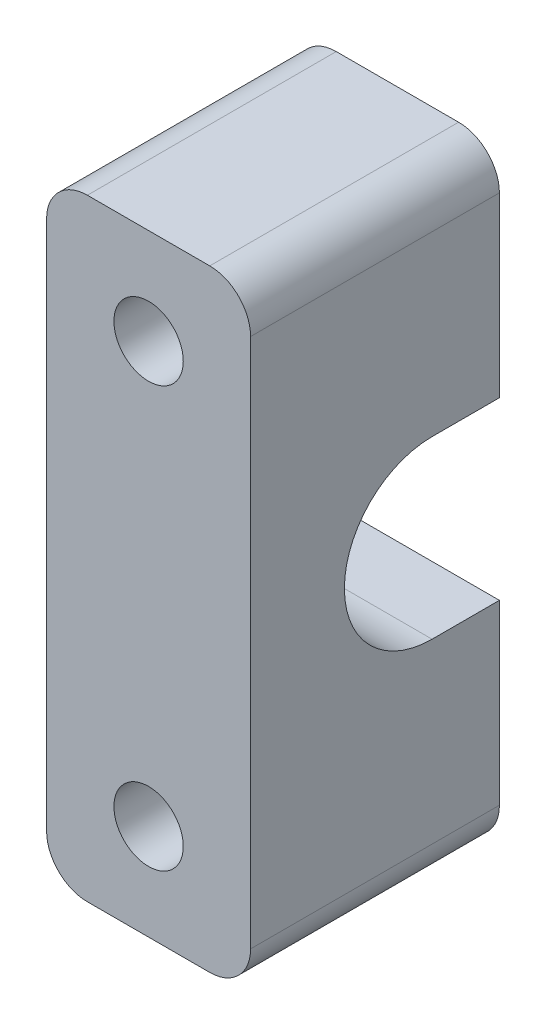
from build123d import *

# Parameters (mm, degrees)
SKETCH1_W           = 12.2
SKETCH1_H           = 30
BOSS_EXTRUDE1_DEPTH = 5
SKETCH5_R           = 4.3
CUT_EXTRUDE2_DEPTH  = 7
SKETCH3_R           = 1.7
CUT_EXTRUDE1_DEPTH  = 20.970978944
FILLET1_R           = 2
FILLET2_R           = 0.1
CUT_EXTRUDE3_DEPTH  = 7


with BuildPart() as part:
    # Sketch1 → Boss-Extrude1 (new, symmetric)
    with BuildSketch(Plane(origin=(0, 0, 0), x_dir=(0, 0, -1), z_dir=(1, 0, 0))):
        Rectangle(SKETCH1_W, SKETCH1_H)
    extrude(amount=BOSS_EXTRUDE1_DEPTH, both=True)

    # Sketch5 → Cut-Extrude2 (cut)
    with BuildSketch(Plane(origin=(5, 0, 0), x_dir=(0, 0, -1), z_dir=(1, 0, 0))):
        with Locations((2.8, 0)):
            Circle(SKETCH5_R)
    extrude(amount=-CUT_EXTRUDE2_DEPTH, mode=Mode.SUBTRACT)

    # Sketch3 → Cut-Extrude1 (cut, through all)
    with BuildSketch(Plane.XY.offset(6.1)):
        with Locations((0, 10.3)):
            Circle(SKETCH3_R)
    cut_extrude1 = extrude(amount=-CUT_EXTRUDE1_DEPTH, mode=Mode.SUBTRACT)

    # Mirror1: Cut-Extrude1 across plane
    add(cut_extrude1.mirror(Plane.ZX), mode=Mode.SUBTRACT)

    # Fillet1
    fillet1_edges = [part.edges().sort_by_distance(p)[0] for p in [
        (5, -15, 0),
        (-5, -15, 0),
        (-5, 15, 0),
        (5, 15, 0),
    ]]
    fillet(fillet1_edges, radius=FILLET1_R)

    # Fillet2
    fillet2_edges = [part.edges().sort_by_distance(p)[0] for p in [
        (1.5, -2.75680975, -6.1),
        (1.5, 2.75680975, -6.1),
    ]]
    fillet(fillet2_edges, radius=FILLET2_R)

    # Sketch6 → Cut-Extrude3 (cut)
    with BuildSketch(Plane(origin=(5, 0, 0), x_dir=(0, 0, -1), z_dir=(1, 0, 0))):
        with BuildLine():
            Line((2.8, 4.3), (6.1, 4.3))
            ThreePointArc((6.1, 4.3), (10.4, 0), (6.1, -4.3))
            Line((6.1, -4.3), (2.8, -4.3))
            ThreePointArc((2.8, -4.3), (-1.5, 0), (2.8, 4.3))
        make_face()
    extrude(amount=-CUT_EXTRUDE3_DEPTH, mode=Mode.SUBTRACT)


solid = part.part
